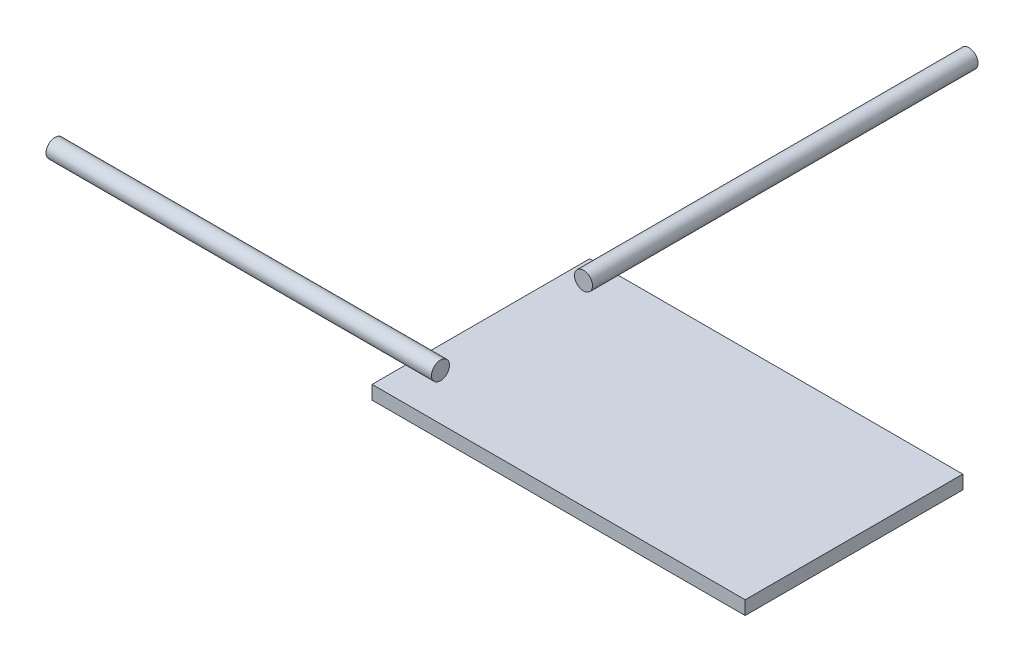
from build123d import *

# Parameters (mm, degrees)
SKETCH1_W           = 30
SKETCH1_H           = 17.5
BOSS_EXTRUDE1_DEPTH = 1.1
SKETCH2_R           = 0.725
BOSS_EXTRUDE2_DEPTH = 28.5
SKETCH4_R           = 0.725
BOSS_EXTRUDE3_DEPTH = 28.5
SKETCH6_R           = 0.725
BOSS_EXTRUDE4_DEPTH = 2.5
SKETCH7_R           = 0.725
BOSS_EXTRUDE5_DEPTH = 2.5


with BuildPart() as part:
    # Sketch1 → Boss-Extrude1 (new body)
    with BuildSketch(Plane(origin=(0, 0, 0), x_dir=(1, 0, 0), z_dir=(0, 1, 0))):
        Rectangle(SKETCH1_W, SKETCH1_H)
    extrude(amount=BOSS_EXTRUDE1_DEPTH)


with BuildPart() as body_2:
    # Sketch2 → Boss-Extrude2 (new body)
    with BuildSketch(Plane(origin=(0, 0, -8.75), x_dir=(-1, 0, 0), z_dir=(0, 0, -1))):
        with Locations(Location((13, 1.825, 0), (0, 0, 180))):
            Circle(SKETCH2_R)
    extrude(amount=BOSS_EXTRUDE2_DEPTH)

    # Sketch6 → Boss-Extrude4 (add)
    with BuildSketch(Plane.XY.offset(-8.75)):
        with Locations((-13, 1.825)):
            Circle(SKETCH6_R)
    extrude(amount=BOSS_EXTRUDE4_DEPTH)


with BuildPart() as body_3:
    # Sketch4 → Boss-Extrude3 (new body)
    with BuildSketch(Plane.ZY.offset(15)):
        with Locations(Location((5.75, 1.825, 0), (0, 0, 180))):
            Circle(SKETCH4_R)
    extrude(amount=BOSS_EXTRUDE3_DEPTH)

    # Sketch7 → Boss-Extrude5 (add)
    with BuildSketch(Plane(origin=(-15, 0, 0), x_dir=(0, 0, -1), z_dir=(1, 0, 0))):
        with Locations((-5.75, 1.825)):
            Circle(SKETCH7_R)
    extrude(amount=BOSS_EXTRUDE5_DEPTH)


solid = Compound([part.part, body_2.part, body_3.part])
